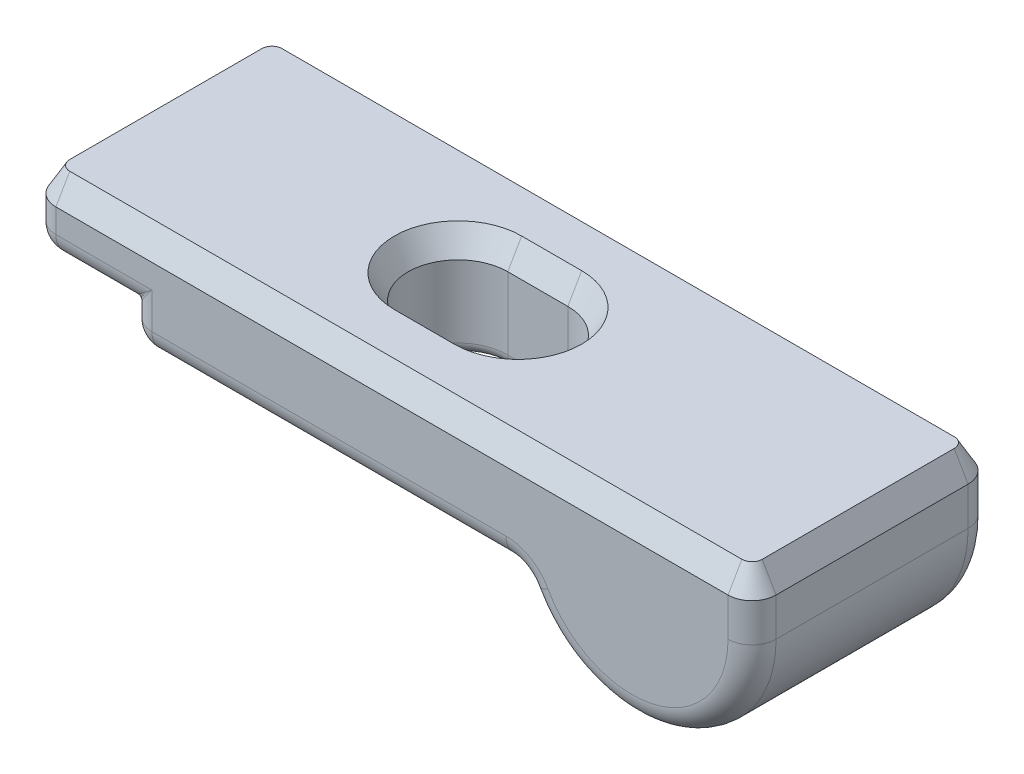
from build123d import *
from OCP.BRepFilletAPI import BRepFilletAPI_MakeChamfer

# Parameters (mm, degrees)
BOSS_EXTRUDE1_DEPTH = 20
CUT_EXTRUDE1_REACH  = 67.044
FILLET1_R           = 2
CHAMFER1_SIZE       = 2
CHAMFER1_SIZE2      = 1.154700538
CHAMFER2_SIZE       = 2
CHAMFER2_SIZE2      = 1.154700538
FILLET2_R           = 1
FILLET3_R           = 0.5


with BuildPart() as part:
    # Sketch1 → Boss-Extrude1 (new body)
    with BuildSketch(Plane.XY):
        with BuildLine():
            Line((0, 0), (8, 0))
            Line((8, 0), (8, -3))
            Line((8, -3), (40.754109963, -3))
            ThreePointArc((40.754109963, -3), (51.941790363, -9), (60, 0.809661064))
            Line((60, 0.809661064), (60, 6))
            Line((60, 6), (0, 6))
            Line((0, 6), (0, 0))
        make_face()
    extrude(amount=BOSS_EXTRUDE1_DEPTH)

    # Sketch2 → Cut-Extrude1 (cut, up to next)
    with BuildSketch(Plane(origin=(0, 6, 0), x_dir=(1, 0, 0), z_dir=(0, 1, 0)), mode=Mode.PRIVATE) as cut_extrude1_sk1:
        with BuildLine():
            Line((25.5, -5.85), (30.5, -5.85))
            ThreePointArc((30.5, -5.85), (34.65, -10), (30.5, -14.15))
            Line((30.5, -14.15), (25.5, -14.15))
            ThreePointArc((25.5, -14.15), (21.35, -10), (25.5, -5.85))
        make_face()
    cut_extrude1_tool1 = extrude(cut_extrude1_sk1.sketch, amount=-CUT_EXTRUDE1_REACH, mode=Mode.PRIVATE) & part.part
    add(cut_extrude1_tool1.solids().sort_by_distance((28, 6, 10))[0], mode=Mode.SUBTRACT)

    # Fillet1
    fillet1_edges = [part.edges().sort_by_distance(p)[0] for p in [
        (0, 3, 0),
        (8, -1.5, 20),
        (40.754109963, -3, 10),
        (8, -3, 10),
        (0, 0, 10),
        (24.377054981, -3, 20),
        (51.941790363, -9, 20),
        (60, 3.404830532, 20),
        (0, 3, 20),
        (60, 3.404830532, 0),
        (51.941790363, -9, 0),
        (24.377054981, -3, 0),
        (4, 0, 20),
        (8, -1.5, 0),
        (4, 0, 0),
    ]]
    fillet(fillet1_edges, radius=FILLET1_R)

    # Chamfer1: one chamfer whose edges measure the first distance from different faces: ONE call of the kernel's chamfer builder (chamfer() names one face for all edges)
    chamfer1_edges_1 = [part.edges().sort_by_distance(p)[0] for p in [
        (30, 6, 0),
    ]]
    chamfer1_side_1 = [part.faces().sort_by_distance(p)[0] for p in [
        (34.587898507, 1.608386823, 0),
    ]]
    chamfer1_edges_2 = [part.edges().sort_by_distance(p)[0] for p in [
        (30, 6, 20),
    ]]
    chamfer1_side_2 = [part.faces().sort_by_distance(p)[0] for p in [
        (34.587898507, 1.608386823, 20),
    ]]
    chamfer1_edges_3 = [part.edges().sort_by_distance(p)[0] for p in [
        (60, 6, 10),
    ]]
    chamfer1_side_3 = [part.faces().sort_by_distance(p)[0] for p in [
        (60, 3.404830532, 10),
    ]]
    chamfer1_edges_4 = [part.edges().sort_by_distance(p)[0] for p in [
        (0, 6, 10),
    ]]
    chamfer1_side_4 = [part.faces().sort_by_distance(p)[0] for p in [
        (0, 4, 10),
    ]]
    chamfer1_edges_5 = [part.edges().sort_by_distance(p)[0] for p in [
        (0.585786438, 6, 19.414213562),
    ]]
    chamfer1_side_5 = [part.faces().sort_by_distance(p)[0] for p in [
        (0.585786438, 4, 19.414213562),
    ]]
    chamfer1_edges_6 = [part.edges().sort_by_distance(p)[0] for p in [
        (0.585786438, 6, 0.585786438),
    ]]
    chamfer1_side_6 = [part.faces().sort_by_distance(p)[0] for p in [
        (0.585786438, 4, 0.585786438),
    ]]
    chamfer1_edges_7 = [part.edges().sort_by_distance(p)[0] for p in [
        (59.414213562, 6, 19.414213562),
    ]]
    chamfer1_side_7 = [part.faces().sort_by_distance(p)[0] for p in [
        (59.414213562, 3.404830532, 19.414213562),
    ]]
    chamfer1_edges_8 = [part.edges().sort_by_distance(p)[0] for p in [
        (59.414213562, 6, 0.585786438),
    ]]
    chamfer1_side_8 = [part.faces().sort_by_distance(p)[0] for p in [
        (59.414213562, 3.404830532, 0.585786438),
    ]]
    chamfer1 = BRepFilletAPI_MakeChamfer(part.part.solid().wrapped)
    for e in chamfer1_edges_1:
        chamfer1.Add(CHAMFER1_SIZE, CHAMFER1_SIZE2, e.wrapped, chamfer1_side_1[0].wrapped)  # the first distance lies on this face
    for e in chamfer1_edges_2:
        chamfer1.Add(CHAMFER1_SIZE, CHAMFER1_SIZE2, e.wrapped, chamfer1_side_2[0].wrapped)  # the first distance lies on this face
    for e in chamfer1_edges_3:
        chamfer1.Add(CHAMFER1_SIZE, CHAMFER1_SIZE2, e.wrapped, chamfer1_side_3[0].wrapped)  # the first distance lies on this face
    for e in chamfer1_edges_4:
        chamfer1.Add(CHAMFER1_SIZE, CHAMFER1_SIZE2, e.wrapped, chamfer1_side_4[0].wrapped)  # the first distance lies on this face
    for e in chamfer1_edges_5:
        chamfer1.Add(CHAMFER1_SIZE, CHAMFER1_SIZE2, e.wrapped, chamfer1_side_5[0].wrapped)  # the first distance lies on this face
    for e in chamfer1_edges_6:
        chamfer1.Add(CHAMFER1_SIZE, CHAMFER1_SIZE2, e.wrapped, chamfer1_side_6[0].wrapped)  # the first distance lies on this face
    for e in chamfer1_edges_7:
        chamfer1.Add(CHAMFER1_SIZE, CHAMFER1_SIZE2, e.wrapped, chamfer1_side_7[0].wrapped)  # the first distance lies on this face
    for e in chamfer1_edges_8:
        chamfer1.Add(CHAMFER1_SIZE, CHAMFER1_SIZE2, e.wrapped, chamfer1_side_8[0].wrapped)  # the first distance lies on this face
    add(Compound.cast(chamfer1.Shape()), mode=Mode.REPLACE)

    # Chamfer2: one chamfer whose edges measure the first distance from different faces: ONE call of the kernel's chamfer builder (chamfer() names one face for all edges)
    chamfer2_edges_1 = [part.edges().sort_by_distance(p)[0] for p in [
        (21.35, 6, 10),
    ]]
    chamfer2_side_1 = [part.faces().sort_by_distance(p)[0] for p in [
        (21.35, 1.5, 10),
    ]]
    chamfer2_edges_2 = [part.edges().sort_by_distance(p)[0] for p in [
        (28, 6, 14.15),
    ]]
    chamfer2_side_2 = [part.faces().sort_by_distance(p)[0] for p in [
        (28, 1.5, 14.15),
    ]]
    chamfer2_edges_3 = [part.edges().sort_by_distance(p)[0] for p in [
        (34.65, 6, 10),
    ]]
    chamfer2_side_3 = [part.faces().sort_by_distance(p)[0] for p in [
        (34.65, 1.5, 10),
    ]]
    chamfer2_edges_4 = [part.edges().sort_by_distance(p)[0] for p in [
        (28, 6, 5.85),
    ]]
    chamfer2_side_4 = [part.faces().sort_by_distance(p)[0] for p in [
        (28, 1.5, 5.85),
    ]]
    chamfer2 = BRepFilletAPI_MakeChamfer(part.part.solid().wrapped)
    for e in chamfer2_edges_1:
        chamfer2.Add(CHAMFER2_SIZE, CHAMFER2_SIZE2, e.wrapped, chamfer2_side_1[0].wrapped)  # the first distance lies on this face
    for e in chamfer2_edges_2:
        chamfer2.Add(CHAMFER2_SIZE, CHAMFER2_SIZE2, e.wrapped, chamfer2_side_2[0].wrapped)  # the first distance lies on this face
    for e in chamfer2_edges_3:
        chamfer2.Add(CHAMFER2_SIZE, CHAMFER2_SIZE2, e.wrapped, chamfer2_side_3[0].wrapped)  # the first distance lies on this face
    for e in chamfer2_edges_4:
        chamfer2.Add(CHAMFER2_SIZE, CHAMFER2_SIZE2, e.wrapped, chamfer2_side_4[0].wrapped)  # the first distance lies on this face
    add(Compound.cast(chamfer2.Shape()), mode=Mode.REPLACE)

    # Fillet2
    fillet2_edges = [part.edges().sort_by_distance(p)[0] for p in [
        (28, -3, 14.15),
        (21.35, -3, 10),
        (28, -3, 5.85),
        (34.65, -3, 10),
    ]]
    fillet(fillet2_edges, radius=FILLET2_R)

    # Fillet3
    fillet3_edges = [part.edges().sort_by_distance(p)[0] for p in [
        (8, 0, 10),
        (8.707902185, 0.707902185, 19.526592034),
        (8.707902185, 0.707902185, 0.473407966),
    ]]
    fillet(fillet3_edges, radius=FILLET3_R)


solid = part.part
